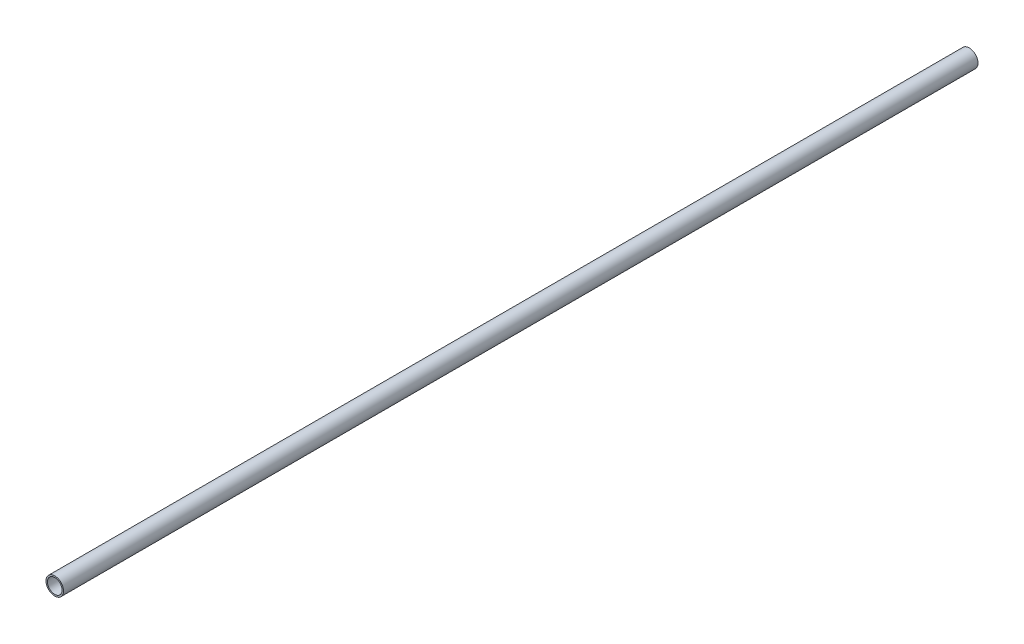
from build123d import *

# Parameters (mm, degrees)
SKETCH1_R      = 6
SKETCH1_R_2    = 5
EXTRUDE1_DEPTH = 312.5


with BuildPart() as part:
    # Sketch1 → Extrude1 (new, symmetric)
    with BuildSketch(Plane.XY):
        Circle(SKETCH1_R)
        Circle(SKETCH1_R_2, mode=Mode.SUBTRACT)
    extrude(amount=EXTRUDE1_DEPTH, both=True)


solid = part.part
